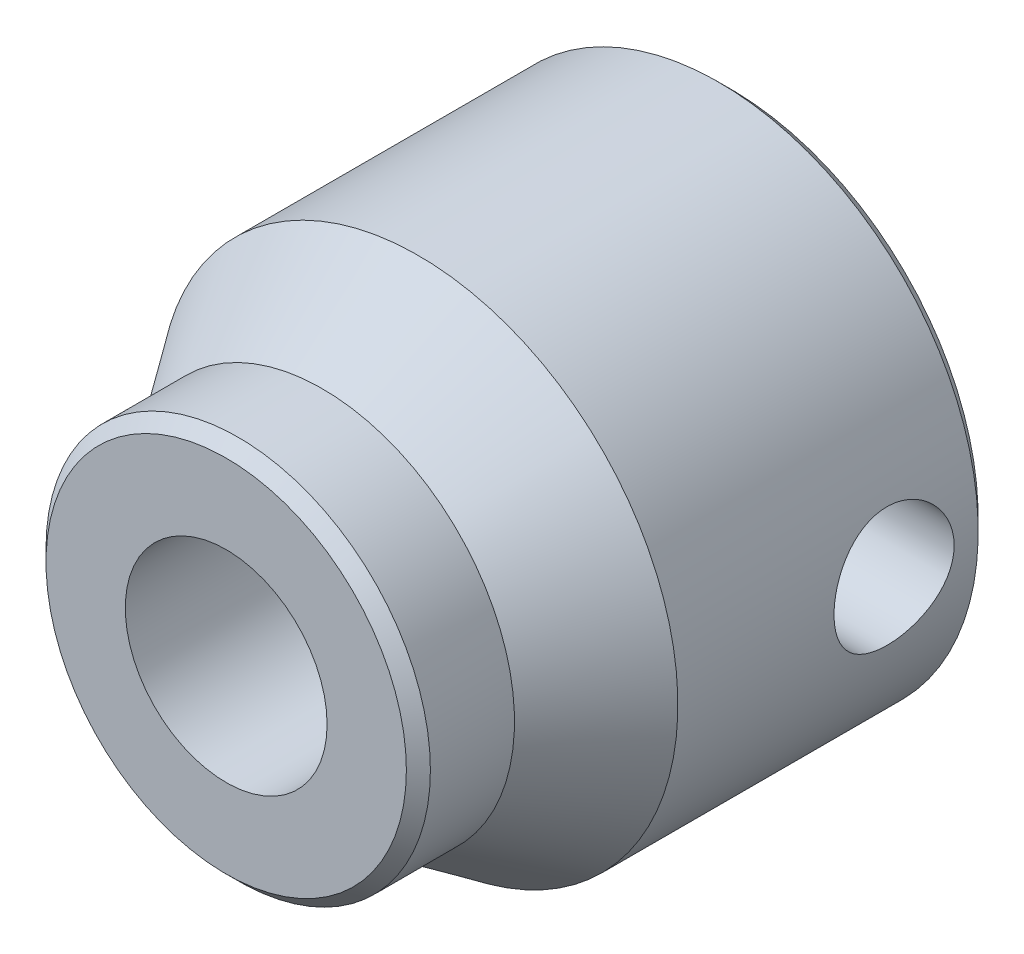
from build123d import *

# Parameters (mm, degrees)
CONNECTOR_M5X0_8_TAPPED_HOLE_D        = 4.2
CONNECTOR_M5X0_8_TAPPED_HOLE_DEPTH    = 7.4
CONNECTOR_M5X0_8_TAPPED_HOLE_TIP      = 1.2618073
SET_SCREW_1_M3X0_5_TAPPED_HOLE_REACH  = 16.767
SET_SCREW_1_M3X0_5_TAPPED_HOLE_BORE_R = 1.25
EDGE_CHAMFERS_SIZE                    = 0.25


with BuildPart() as part:
    # Body Sketch → Body Revolve (revolve)
    with BuildSketch(Plane(origin=(0, 0, 0), x_dir=(-1, 0, 0), z_dir=(0, 1, 0))):
        Polygon((1, 10.5), (4, 10.5), (4, 8.5), (5.4, 6.5), (5.4, 0), (2.5, 0), (2.5, 6), (1, 6), align=None)
    revolve(axis=Axis((0, 0, 0), (0, 0, 1)))

    # Connector M5x0.8 Tapped Hole
    with Locations(Plane.XY.offset(10.5)):
        with Locations((0, 0)):
            Hole(CONNECTOR_M5X0_8_TAPPED_HOLE_D / 2, depth=CONNECTOR_M5X0_8_TAPPED_HOLE_DEPTH)
            with Locations((0, 0, -(CONNECTOR_M5X0_8_TAPPED_HOLE_DEPTH + CONNECTOR_M5X0_8_TAPPED_HOLE_TIP / 2))):  # 118° drill point
                Cone(0, CONNECTOR_M5X0_8_TAPPED_HOLE_D / 2, CONNECTOR_M5X0_8_TAPPED_HOLE_TIP, mode=Mode.SUBTRACT)

    # Set Screw 1 M3x0.5 Tapped Hole bore (on position points) → Set Screw 1 M3x0.5 Tapped Hole (cut, up to next)
    with BuildSketch(Plane(origin=(5.4, 0, 2), x_dir=(0, 1, 0), z_dir=(1, 0, 0)), mode=Mode.PRIVATE) as set_screw_1_m3x0_5_tapped_hole_sk1:
        Circle(SET_SCREW_1_M3X0_5_TAPPED_HOLE_BORE_R)
    set_screw_1_m3x0_5_tapped_hole_tool1 = extrude(set_screw_1_m3x0_5_tapped_hole_sk1.sketch, amount=-SET_SCREW_1_M3X0_5_TAPPED_HOLE_REACH, mode=Mode.PRIVATE) & part.part
    add(set_screw_1_m3x0_5_tapped_hole_tool1.solids().sort_by_distance((5.4, 0, 2))[0], mode=Mode.SUBTRACT)

    # Edge Chamfers
    edge_chamfers_edges = [part.edges().sort_by_distance(p)[0] for p in [
        (5.4, 0, 0),
        (4, 0, 10.5),
    ]]
    chamfer(edge_chamfers_edges, length=EDGE_CHAMFERS_SIZE)


solid = part.part
